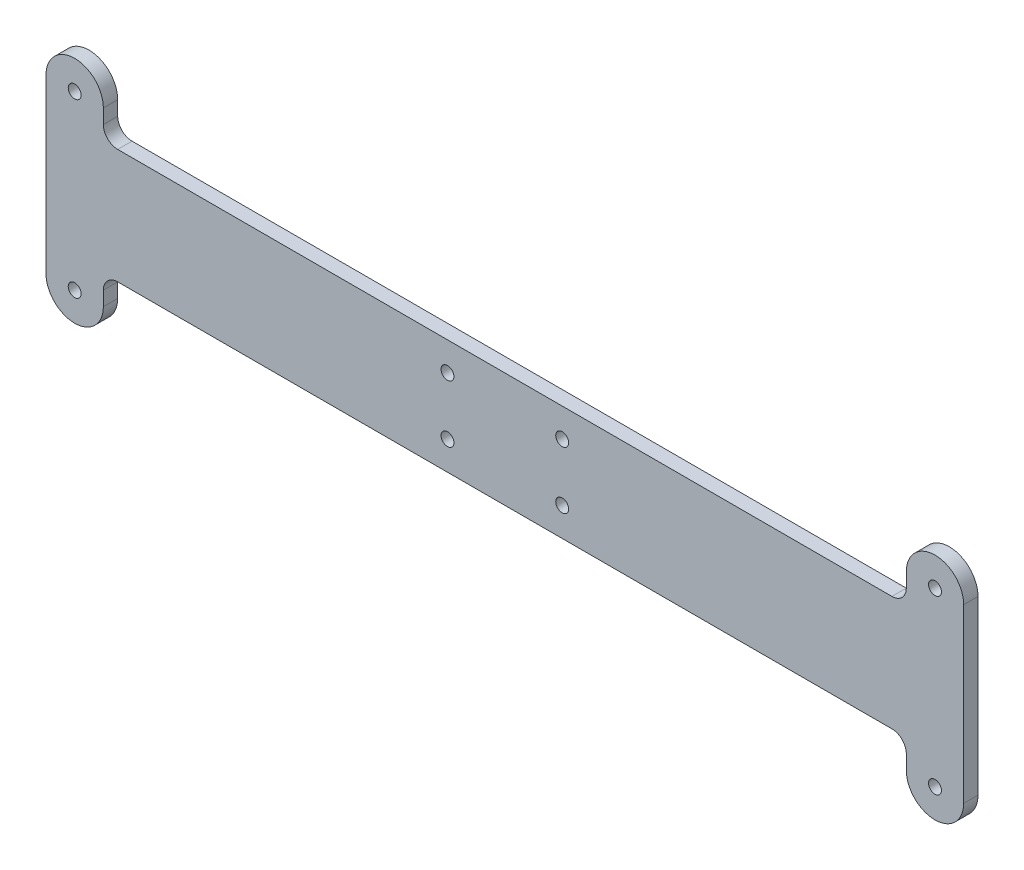
from build123d import *

# Parameters (mm, degrees)
BOSS_EXTRU_1_DEPTH = 5
D_GAGEMENT_M41_D   = 4.5
D_GAGEMENT_M42_D   = 4.5


with BuildPart() as part:
    # Esquisse1 → Boss.-Extru.1 (new body)
    with BuildSketch(Plane.XY):
        with BuildLine():
            Line((-135, 0), (135, 0))
            ThreePointArc((135, 0), (138.535533906, -1.464466094), (140, -5))
            Line((140, -5), (140, -10))
            ThreePointArc((140, -10), (150, -20), (160, -10))
            Line((160, -10), (160, 50))
            ThreePointArc((160, 50), (150, 60), (140, 50))
            Line((140, 50), (140, 45))
            ThreePointArc((140, 45), (138.535533906, 41.464466094), (135, 40))
            Line((135, 40), (-135, 40))
            ThreePointArc((-135, 40), (-138.535533906, 41.464466094), (-140, 45))
            Line((-140, 45), (-140, 50))
            ThreePointArc((-140, 50), (-150, 60), (-160, 50))
            Line((-160, 50), (-160, -10))
            ThreePointArc((-160, -10), (-150, -20), (-140, -10))
            Line((-140, -10), (-140, -5))
            ThreePointArc((-140, -5), (-138.535533906, -1.464466094), (-135, 0))
        make_face()
    extrude(amount=BOSS_EXTRU_1_DEPTH)

    # Dégagement M41 (through all)
    with Locations(Plane(origin=(0, 0, 0), x_dir=(-1, 0, 0), z_dir=(0, 0, -1))):
        with Locations((-150, -10), (150, 50), (150, -10), (-150, 50)):
            Hole(D_GAGEMENT_M41_D / 2)

    # Dégagement M42 (through all)
    with Locations(Plane(origin=(0, 0, 0), x_dir=(-1, 0, 0), z_dir=(0, 0, -1))):
        with Locations((20, 10), (-20, 10), (-20, 30), (20, 30)):
            Hole(D_GAGEMENT_M42_D / 2)


solid = part.part
